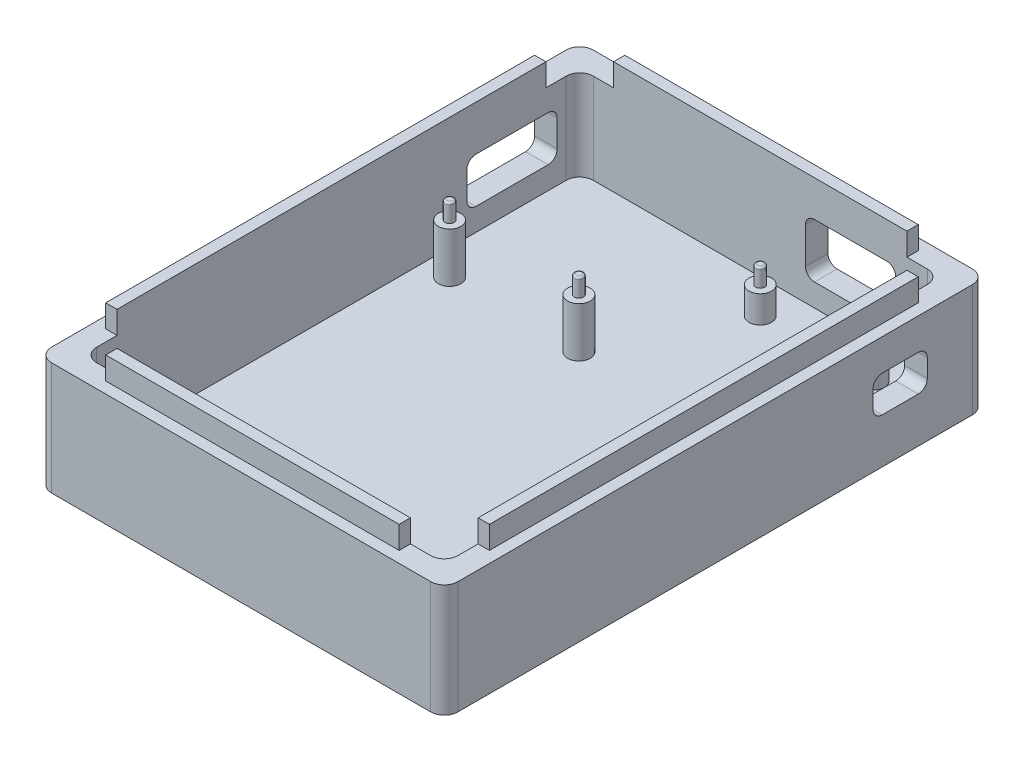
from build123d import *

# Parameters (mm, degrees)
CROQUIS1_W              = 90
CROQUIS1_H              = 120
SALIENTE_EXTRUIR1_DEPTH = 30
CROQUIS2_W              = 80
CROQUIS2_H              = 110
CORTAR_EXTRUIR1_DEPTH   = 25
CROQUIS3_W              = 90
CROQUIS3_H              = 120
CORTAR_EXTRUIR2_DEPTH   = 5
CROQUIS4_R              = 2.5
SALIENTE_EXTRUIR2_DEPTH = 6
CROQUIS5_R              = 1
SALIENTE_EXTRUIR3_DEPTH = 4
CROQUIS7_R              = 2.5
SALIENTE_EXTRUIR4_DEPTH = 11
CROQUIS8_R              = 1
SALIENTE_EXTRUIR5_DEPTH = 4
CROQUIS10_W             = 20
CROQUIS10_H             = 12
CORTAR_EXTRUIR3_DEPTH   = 5
CROQUIS11_W             = 12
CROQUIS11_H             = 8
CORTAR_EXTRUIR4_DEPTH   = 5
CROQUIS12_W             = 20
CROQUIS12_H             = 10
CORTAR_EXTRUIR5_DEPTH   = 5
REDONDEO1_R             = 3
REDONDEO2_R             = 2
REDONDEO3_R             = 3
REDONDEO4_R             = 0.4


with BuildPart() as part:
    # Croquis1 → Saliente-Extruir1 (new body)
    with BuildSketch(Plane(origin=(0, 0, 0), x_dir=(1, 0, 0), z_dir=(0, 1, 0))):
        Rectangle(CROQUIS1_W, CROQUIS1_H)
    extrude(amount=SALIENTE_EXTRUIR1_DEPTH)

    # Croquis2 → Cortar-Extruir1 (cut)
    with BuildSketch(Plane(origin=(0, 30, 0), x_dir=(1, 0, 0), z_dir=(0, 1, 0))):
        Rectangle(CROQUIS2_W, CROQUIS2_H)
    extrude(amount=-CORTAR_EXTRUIR1_DEPTH, mode=Mode.SUBTRACT)

    # Croquis3 → Cortar-Extruir2 (cut)
    with BuildSketch(Plane(origin=(0, 30, 0), x_dir=(1, 0, 0), z_dir=(0, 1, 0))):
        Rectangle(CROQUIS3_W, CROQUIS3_H)
        Polygon((32.5, -57.5), (-32.5, -57.5), (-32.5, -47.5), (-42.5, -47.5), (-42.5, 47.5), (-32.5, 47.5), (-32.5, 57.5), (32.5, 57.5), (32.5, 47.5), (42.5, 47.5), (42.5, -47.5), (32.5, -47.5), align=None, mode=Mode.SUBTRACT)
    extrude(amount=-CORTAR_EXTRUIR2_DEPTH, mode=Mode.SUBTRACT)

    # Croquis4 → Saliente-Extruir2 (add)
    with BuildSketch(Plane(origin=(0, 5, 0), x_dir=(1, 0, 0), z_dir=(0, 1, 0))):
        with Locations(Location((7.5, 47.5, 0), (0, 0, 270))):
            Circle(CROQUIS4_R)
        with Locations(Location((32.5, 47.5, 0), (0, 0, 270))):
            Circle(CROQUIS4_R)
        with Locations(Location((32.5, -47.5, 0), (0, 0, 270))):
            Circle(CROQUIS4_R)
        with Locations(Location((7.5, -47.5, 0), (0, 0, 270))):
            Circle(CROQUIS4_R)
    extrude(amount=SALIENTE_EXTRUIR2_DEPTH)

    # Croquis5 → Saliente-Extruir3 (add)
    with BuildSketch(Plane(origin=(0, 11, 0), x_dir=(1, 0, 0), z_dir=(0, 1, 0))):
        with Locations(Location((7.5, 47.5, 0), (0, 0, 270))):
            Circle(CROQUIS5_R)
        with Locations(Location((32.5, 47.5, 0), (0, 0, 270))):
            Circle(CROQUIS5_R)
        with Locations(Location((32.5, -47.5, 0), (0, 0, 270))):
            Circle(CROQUIS5_R)
        with Locations(Location((7.5, -47.5, 0), (0, 0, 270))):
            Circle(CROQUIS5_R)
    extrude(amount=SALIENTE_EXTRUIR3_DEPTH)

    # Croquis7 → Saliente-Extruir4 (add)
    with BuildSketch(Plane(origin=(0, 5, 0), x_dir=(1, 0, 0), z_dir=(0, 1, 0))):
        with Locations(Location((-34.32, 20.5, 0), (0, 0, 270))):
            Circle(CROQUIS7_R)
        with Locations(Location((-5.68, 20.5, 0), (0, 0, 270))):
            Circle(CROQUIS7_R)
        with Locations(Location((-5.68, -47.5, 0), (0, 0, 270))):
            Circle(CROQUIS7_R)
        with Locations(Location((-34.32, -47.5, 0), (0, 0, 270))):
            Circle(CROQUIS7_R)
    extrude(amount=SALIENTE_EXTRUIR4_DEPTH)

    # Croquis8 → Saliente-Extruir5 (add)
    with BuildSketch(Plane(origin=(0, 16, 0), x_dir=(1, 0, 0), z_dir=(0, 1, 0))):
        with Locations(Location((-34.32, 20.5, 0), (0, 0, 270))):
            Circle(CROQUIS8_R)
        with Locations(Location((-5.68, 20.5, 0), (0, 0, 270))):
            Circle(CROQUIS8_R)
        with Locations(Location((-5.68, -47.5, 0), (0, 0, 270))):
            Circle(CROQUIS8_R)
        with Locations(Location((-34.32, -47.5, 0), (0, 0, 270))):
            Circle(CROQUIS8_R)
    extrude(amount=SALIENTE_EXTRUIR5_DEPTH)

    # Croquis10 → Cortar-Extruir3 (cut)
    with BuildSketch(Plane(origin=(0, 0, -60), x_dir=(-1, 0, 0), z_dir=(0, 0, -1))):
        with Locations((-20, 16)):
            Rectangle(CROQUIS10_W, CROQUIS10_H)
    extrude(amount=-CORTAR_EXTRUIR3_DEPTH, mode=Mode.SUBTRACT)

    # Croquis11 → Cortar-Extruir4 (cut)
    with BuildSketch(Plane(origin=(45, 0, 0), x_dir=(0, 0, -1), z_dir=(1, 0, 0))):
        with Locations((41, 14)):
            Rectangle(CROQUIS11_W, CROQUIS11_H)
    extrude(amount=-CORTAR_EXTRUIR4_DEPTH, mode=Mode.SUBTRACT)

    # Croquis12 → Cortar-Extruir5 (cut)
    with BuildSketch(Plane.ZY.offset(45)):
        with Locations((-40, 15)):
            Rectangle(CROQUIS12_W, CROQUIS12_H)
    extrude(amount=-CORTAR_EXTRUIR5_DEPTH, mode=Mode.SUBTRACT)

    # Redondeo1
    redondeo1_edges = [part.edges().sort_by_distance(p)[0] for p in [
        (-45, 12.5, -60),
        (45, 12.5, -60),
        (45, 12.5, 60),
        (-45, 12.5, 60),
    ]]
    fillet(redondeo1_edges, radius=REDONDEO1_R)

    # Redondeo2
    redondeo2_edges = [part.edges().sort_by_distance(p)[0] for p in [
        (30, 10, -57.5),
        (30, 22, -57.5),
        (10, 22, -57.5),
        (10, 10, -57.5),
        (42.5, 10, -35),
        (42.5, 18, -35),
        (42.5, 18, -47),
        (42.5, 10, -47),
        (-42.5, 10, -50),
        (-42.5, 20, -50),
        (-42.5, 20, -30),
        (-42.5, 10, -30),
    ]]
    fillet(redondeo2_edges, radius=REDONDEO2_R)

    # Redondeo3
    redondeo3_edges = [part.edges().sort_by_distance(p)[0] for p in [
        (-40, 15, 55),
        (-40, 15, -55),
        (40, 15, -55),
        (40, 15, 55),
    ]]
    fillet(redondeo3_edges, radius=REDONDEO3_R)

    # Redondeo4
    redondeo4_edges = [part.edges().sort_by_distance(p)[0] for p in [
        (7.5, 15, -48.5),
        (32.5, 15, -48.5),
        (32.5, 15, 46.5),
        (7.5, 15, 46.5),
        (-34.32, 20, -21.5),
        (-5.68, 20, -21.5),
        (-5.68, 20, 46.5),
        (-34.32, 20, 46.5),
    ]]
    fillet(redondeo4_edges, radius=REDONDEO4_R)


solid = part.part
